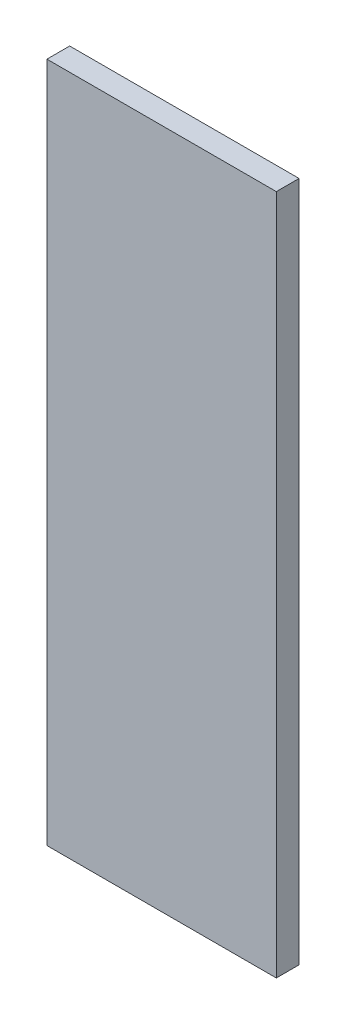
from build123d import *

# Parameters (mm, degrees)
ESQUISSE1_W        = 16
ESQUISSE1_H        = 47.5
BOSS_EXTRU_1_DEPTH = 1.5875


with BuildPart() as part:
    # Esquisse1 → Boss.-Extru.1 (new body)
    with BuildSketch(Plane.XY):
        with Locations((-12.275250836, 0.389130435)):
            Rectangle(ESQUISSE1_W, ESQUISSE1_H)
    extrude(amount=BOSS_EXTRU_1_DEPTH)


solid = part.part
